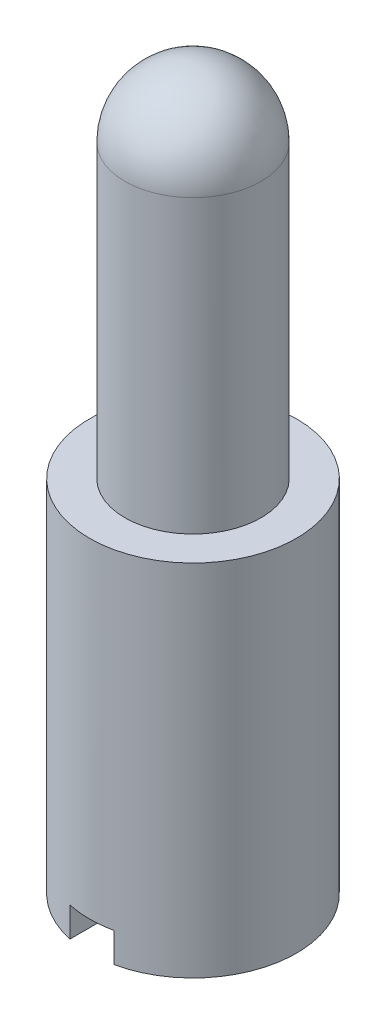
from build123d import *

# Parameters (mm, degrees)
CUT_EXTRUDE1_DEPTH      = 20.441008011
CUT_EXTRUDE1_DEPTH_BACK = 20.441008011
SKETCH2_W               = 1.1684
SKETCH2_H               = 0.7874


with BuildPart() as part:
    # Sketch1 → Revolve1 (revolve)
    with BuildSketch(Plane.XY, mode=Mode.PRIVATE) as revolve1_sk:
        with BuildLine():
            Line((0, 19.05), (0, 0))
            Line((0, 0), (2.7432, 0))
            Line((2.7432, 0), (2.7432, 9.525))
            Line((2.7432, 9.525), (1.8034, 9.525))
            Line((1.8034, 9.525), (1.8034, 17.2466))
            ThreePointArc((1.8034, 17.2466), (1.275196369, 18.521796369), (0, 19.05))
        make_face()
    revolve(revolve1_sk.sketch.rotate(Axis((0, 19.05, 0), (0, -1, 0)), 90), axis=Axis((0, 19.05, 0), (0, -1, 0)))

    # Sketch2 → Cut-Extrude1 (cut, two sides: drawn at the far end of the back side and taken through both)
    with BuildSketch(Plane.XY.offset(-CUT_EXTRUDE1_DEPTH_BACK)):
        with Locations((0, 0.3937)):
            Rectangle(SKETCH2_W, SKETCH2_H)
    extrude(amount=CUT_EXTRUDE1_DEPTH + CUT_EXTRUDE1_DEPTH_BACK, mode=Mode.SUBTRACT)


solid = part.part
